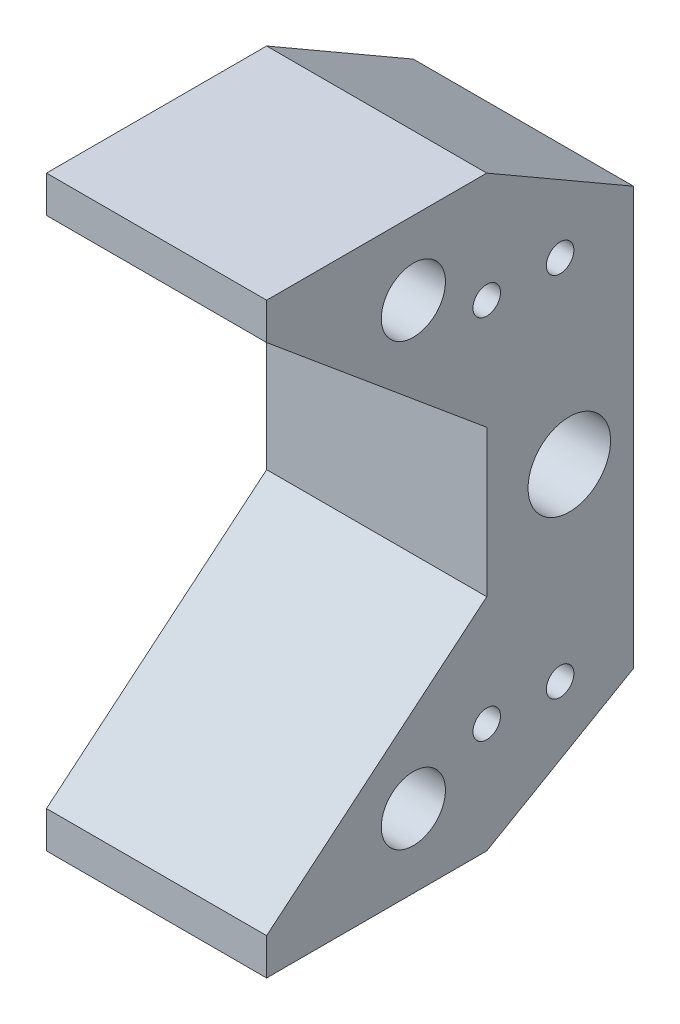
from build123d import *
from build123d.topology import SkipClean

# Parameters (mm, degrees)
SKETCH1_R           = 4.7625
SKETCH1_R_2         = 11.1125
BOSS_EXTRUDE3_DEPTH = 76.2


with BuildPart() as part:
    # Sketch1 → Boss-Extrude3 (new body)
    with BuildSketch(Plane.YZ):
        with BuildLine():
            Line((0, -14.2875), (0, 0))
            Line((0, 0), (-25.4, 0))
            Line((-25.4, 0), (-88.9, 76.2))
            Line((-88.9, 76.2), (-101.6, 76.2))
            Line((-101.6, 76.2), (-101.6, 0))
            Line((-101.6, 0), (-72.270606325, -50.8))
            Line((-72.270606325, -50.8), (0, -50.8))
            Line((0, -50.8), (0, -42.8625))
            ThreePointArc((0, -42.8625), (-14.2875, -28.575), (0, -14.2875))
        make_face()
        with Locations(Location((-63.5, -25.4, 0), (0, 0, 90))):
            Circle(SKETCH1_R, mode=Mode.SUBTRACT)
        with Locations(Location((-63.5, 0, 0), (0, 0, 90))):
            Circle(SKETCH1_R, mode=Mode.SUBTRACT)
        with Locations(Location((-76.2, 25.4, 0), (0, 0, 90))):
            Circle(SKETCH1_R_2, mode=Mode.SUBTRACT)
    extrude(amount=BOSS_EXTRUDE3_DEPTH)

    # Mirror1: part across plane


with BuildPart() as part_1:
    with SkipClean():  # the faces are left unmerged after this step: merging them gives an invalid solid
        add(part.part)
        add(part.part.mirror(Plane(origin=(76.2, 0, 0), x_dir=(0, 0, 1), z_dir=(0, -1, 0))))


solid = part_1.part
